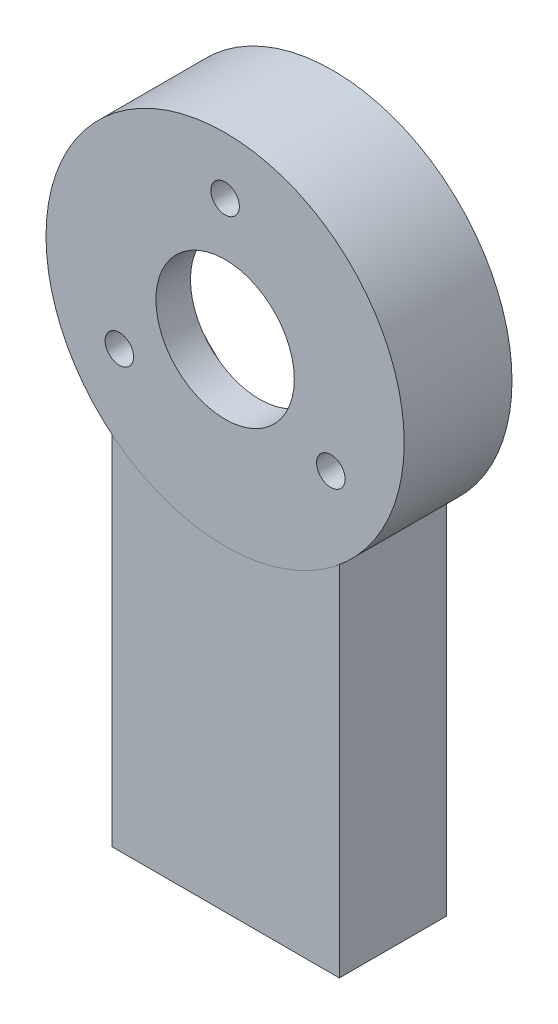
from build123d import *

# Parameters (mm, degrees)
BOSS_EXTRUDE1_DEPTH      = 10
BOSS_EXTRUDE1_DEPTH_BACK = 3.242369731
SKETCH1_R                = 22
SKETCH1_R_2              = 1.75
SKETCH1_R_3              = 8.5
SKETCH2_W                = 27.907133148
SKETCH2_H                = 43.991238144
BOSS_EXTRUDE3_DEPTH      = 13.160474469
SKETCH3_R                = 21.15
CUT_EXTRUDE1_DEPTH       = 9


with BuildPart() as part:
    # Sketch1 → Boss-Extrude1 (new, two sides: drawn at the far end of the back side and taken through both)
    with BuildSketch(Plane.XY.offset(-BOSS_EXTRUDE1_DEPTH_BACK)):
        Circle(SKETCH1_R)
        with Locations((0, 15)):
            Circle(SKETCH1_R_2, mode=Mode.SUBTRACT)
        with Locations((12.990381057, -7.5)):
            Circle(SKETCH1_R_2, mode=Mode.SUBTRACT)
        with Locations((-12.990381057, -7.5)):
            Circle(SKETCH1_R_2, mode=Mode.SUBTRACT)
        Circle(SKETCH1_R_3, mode=Mode.SUBTRACT)
    extrude(amount=BOSS_EXTRUDE1_DEPTH + BOSS_EXTRUDE1_DEPTH_BACK)

    # Sketch2 → Boss-Extrude3 (add)
    with BuildSketch(Plane(origin=(0, 0, -3.242369731), x_dir=(-1, 0, 0), z_dir=(0, 0, -1))):
        with Locations((0, -39.004380928)):
            Rectangle(SKETCH2_W, SKETCH2_H)
    extrude(amount=-BOSS_EXTRUDE3_DEPTH)

    # Sketch3 → Cut-Extrude1 (cut)
    with BuildSketch(Plane(origin=(0, 0, -3.242369731), x_dir=(-1, 0, 0), z_dir=(0, 0, -1))):
        Circle(SKETCH3_R)
    extrude(amount=-CUT_EXTRUDE1_DEPTH, mode=Mode.SUBTRACT)


solid = part.part
